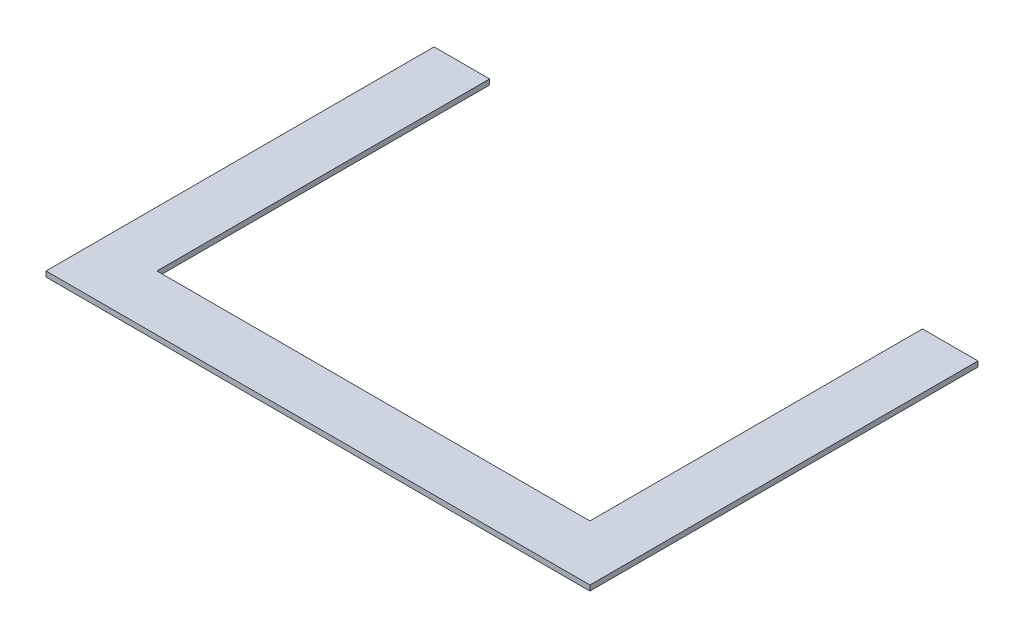
from build123d import *

# Parameters (mm, degrees)
BOSS_EXTRUDE1_DEPTH = 1.8288


with BuildPart() as part:
    # Sketch1 → Boss-Extrude1 (new body)
    with BuildSketch(Plane(origin=(0, 0, 0), x_dir=(1, 0, 0), z_dir=(0, 1, 0))):
        Polygon((-40.50092459, 36.767228689), (-21.34932459, 36.767228689), (-21.34932459, -78.028071311), (128.07887541, -78.028071311), (128.07887541, 36.767228689), (147.23047541, 36.767228689), (147.23047541, -97.179671311), (-40.50092459, -97.179671311), align=None)
    extrude(amount=BOSS_EXTRUDE1_DEPTH)


solid = part.part
